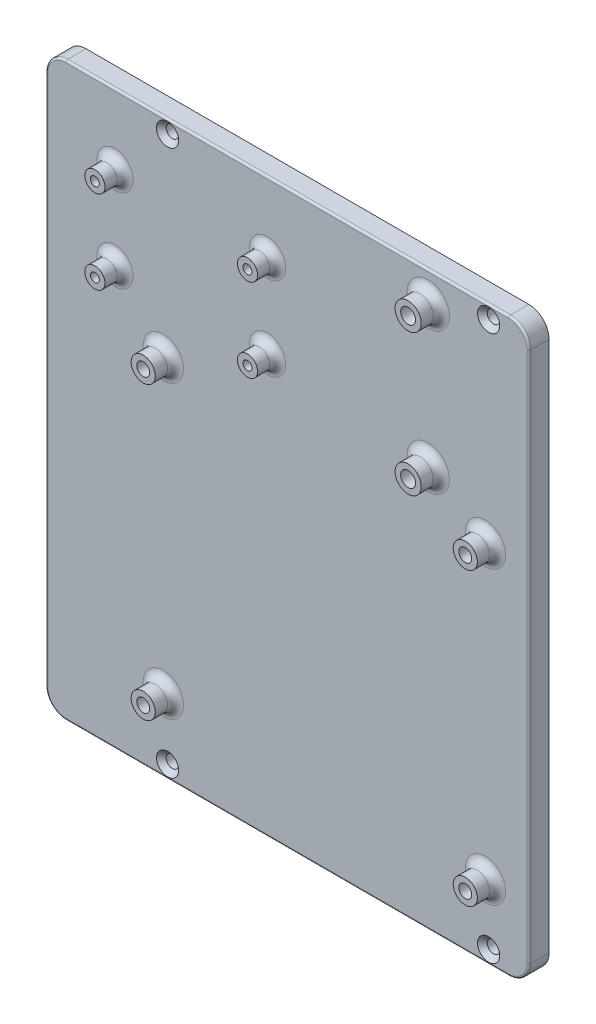
from build123d import *

# Parameters (mm, degrees)
RESSALTO_EXTRUS_O1_DEPTH                             = 5
FILETE2_R                                            = 0.5
ESBO_O6_R                                            = 3
ESBO_O6_R_2                                          = 3.25
ESBO_O6_R_3                                          = 2.5
RESSALTO_EXTRUS_O3_DEPTH                             = 5
FURO_COM_FOLGA_DE_M21_D                              = 2.2
FURO_COM_FOLGA_DE_M31_D                              = 3.2
FURO_COM_FOLGA_DE_M3_51_D                            = 3.7
ESCAREADO_PARA_PARAFUSO_COM_CABE_A_ESCAR_D           = 3.1
ESCAREADO_PARA_PARAFUSO_COM_CABE_A_ESCAR_CSINK_D     = 5.5
ESCAREADO_PARA_PARAFUSO_COM_CABE_A_ESCAR_CSINK_ANGLE = 90
FILETE3_R                                            = 2


with BuildPart() as part:
    # Esboço1 → Ressalto-extrusão1 (new body)
    with BuildSketch(Plane.XY):
        with BuildLine():
            Line((0, -5), (110, -5))
            ThreePointArc((110, -5), (113.535533906, -3.535533906), (115, 0))
            Line((115, 0), (115, 132))
            ThreePointArc((115, 132), (113.535533906, 135.535533906), (110, 137))
            Line((110, 137), (0, 137))
            ThreePointArc((0, 137), (-3.535533906, 135.535533906), (-5, 132))
            Line((-5, 132), (-5, 0))
            ThreePointArc((-5, 0), (-3.535533906, -3.535533906), (0, -5))
        make_face()
    extrude(amount=RESSALTO_EXTRUS_O1_DEPTH)

    # Filete2
    filete2_edges = [part.edges().sort_by_distance(p)[0] for p in [
        (113.535533906, 135.535533906, 5),
        (55, 137, 5),
        (-3.535533906, 135.535533906, 5),
        (-5, 66, 5),
        (-3.535533906, -3.535533906, 5),
        (55, -5, 5),
        (113.535533906, -3.535533906, 5),
        (115, 66, 5),
    ]]
    fillet(filete2_edges, radius=FILETE2_R)

    # Esboço6 → Ressalto-extrusão3 (add)
    with BuildSketch(Plane.XY.offset(5)):
        with Locations((24.2, 85.2)):
            Circle(ESBO_O6_R)
        with Locations((104.2, 85.2)):
            Circle(ESBO_O6_R)
        with Locations((104.2, 12.9)):
            Circle(ESBO_O6_R)
        with Locations((24.2, 12.9)):
            Circle(ESBO_O6_R)
        with Locations((90, 129.55)):
            Circle(ESBO_O6_R_2)
        with Locations((90, 94.45)):
            Circle(ESBO_O6_R_2)
        with Locations(Location((50.1, 98.9, 0), (0, 0, 180))):
            Circle(ESBO_O6_R_3)
        with Locations(Location((12.2, 119.6, 0), (0, 0, 180))):
            Circle(ESBO_O6_R_3)
        with Locations((12.2, 98.9)):
            Circle(ESBO_O6_R_3)
        with Locations((50.1, 119.6)):
            Circle(ESBO_O6_R_3)
    extrude(amount=RESSALTO_EXTRUS_O3_DEPTH)

    # Furo com folga de M21 (through all)
    with Locations(Plane.XY.offset(10)):
        with Locations((12.2, 119.6), (12.2, 98.9), (50.1, 119.6), (50.1, 98.9)):
            Hole(FURO_COM_FOLGA_DE_M21_D / 2)

    # Furo com folga de M31 (through all)
    with Locations(Plane.XY.offset(10)):
        with Locations((24.2, 85.2), (24.2, 12.9), (104.2, 12.9), (104.2, 85.2)):
            Hole(FURO_COM_FOLGA_DE_M31_D / 2)

    # Furo com folga de M3.51 (through all)
    with Locations(Plane.XY.offset(10)):
        with Locations((90, 129.55), (90, 94.45)):
            Hole(FURO_COM_FOLGA_DE_M3_51_D / 2)

    # Escareado para parafuso com cabeça escareada chata de M2.51 (through all)
    with Locations(Plane.XY.offset(5)):
        with Locations((25.25, 133.75), (105, 133.75), (105, -1.75), (25.25, -1.75)):
            CounterSinkHole(ESCAREADO_PARA_PARAFUSO_COM_CABE_A_ESCAR_D / 2, ESCAREADO_PARA_PARAFUSO_COM_CABE_A_ESCAR_CSINK_D / 2, counter_sink_angle=ESCAREADO_PARA_PARAFUSO_COM_CABE_A_ESCAR_CSINK_ANGLE)

    # Filete3
    filete3_edges = [part.edges().sort_by_distance(p)[0] for p in [
        (21.2, 85.2, 5),
        (101.2, 85.2, 5),
        (101.2, 12.9, 5),
        (21.2, 12.9, 5),
        (86.75, 129.55, 5),
        (86.75, 94.45, 5),
        (9.7, 98.9, 5),
        (52.6, 98.9, 5),
        (14.7, 119.6, 5),
        (47.6, 119.6, 5),
    ]]
    fillet(filete3_edges, radius=FILETE3_R)


solid = part.part
